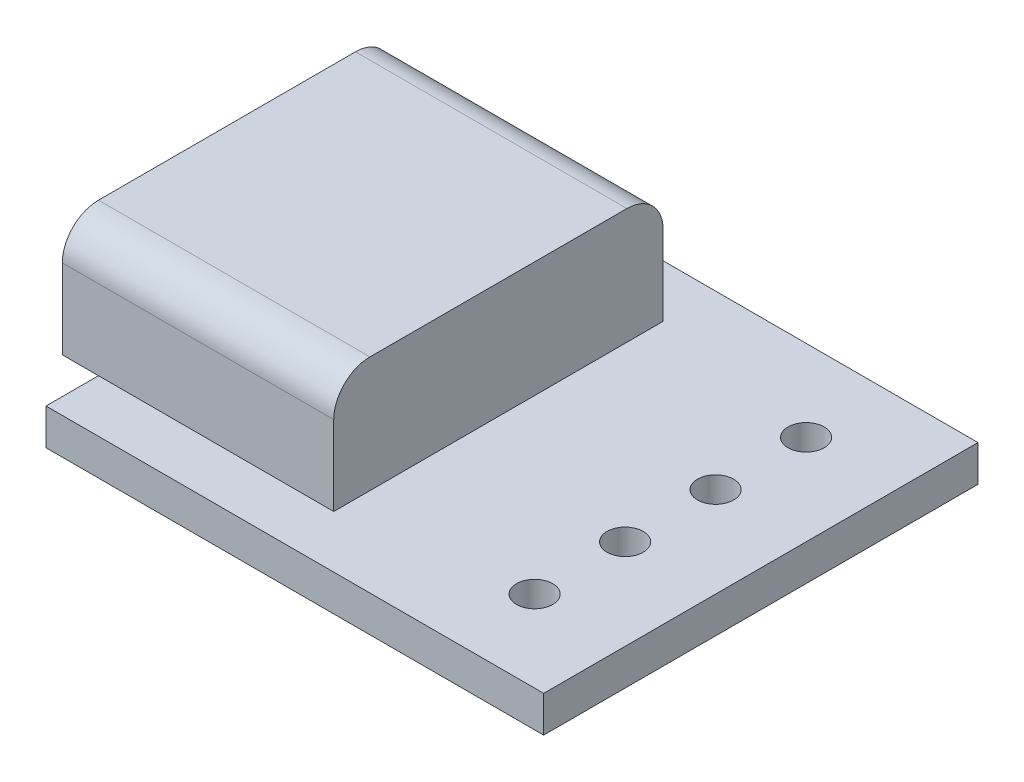
from build123d import *

# Parameters (mm, degrees)
SKETCH1_R           = 0.5
SKETCH1_W           = 6.5
SKETCH1_H           = 9.1
BOSS_EXTRUDE1_DEPTH = 1
BOSS_EXTRUDE2_START = 1
SKETCH1_3_W         = 1
SKETCH1_3_H         = 9.1
SKETCH1_3_W_2       = 6.5
BOSS_EXTRUDE2_DEPTH = 3.2
FILLET1_R           = 1


with BuildPart() as part:
    # Sketch1 → Boss-Extrude1 (new body)
    # profile 1 of 2: a face of its own
    with BuildSketch(Plane(origin=(0, 0, 0), x_dir=(1, 0, 0), z_dir=(0, 1, 0))):
        Polygon((0, 1.45), (0, 0), (13.75, 0), (13.75, 12), (0, 12), (0, 10.55), (6.5, 10.55), (6.5, 1.45), align=None)
        with Locations(Location((11.25, 2.25, 0), (0, 0, 270))):
            Circle(SKETCH1_R, mode=Mode.SUBTRACT)
        with Locations(Location((11.25, 4.75, 0), (0, 0, 270))):
            Circle(SKETCH1_R, mode=Mode.SUBTRACT)
        with Locations(Location((11.25, 7.25, 0), (0, 0, 270))):
            Circle(SKETCH1_R, mode=Mode.SUBTRACT)
        with Locations(Location((11.25, 9.75, 0), (0, 0, 270))):
            Circle(SKETCH1_R, mode=Mode.SUBTRACT)
    # profile 2 of 2: a face of its own
    with BuildSketch(Plane(origin=(0, 0, 0), x_dir=(1, 0, 0), z_dir=(0, 1, 0))):
        with Locations((3.25, 6)):
            Rectangle(SKETCH1_W, SKETCH1_H)
    extrude(amount=BOSS_EXTRUDE1_DEPTH)

    # Sketch1<3> → Boss-Extrude2 (add)
    with BuildSketch(Plane(origin=(0, 0, 0), x_dir=(1, 0, 0), z_dir=(0, 1, 0)).offset(BOSS_EXTRUDE2_START)):
        with Locations((-0.5, 6)):
            Rectangle(SKETCH1_3_W, SKETCH1_3_H)
        with Locations((3.25, 6)):
            Rectangle(SKETCH1_3_W_2, SKETCH1_3_H)
    extrude(amount=BOSS_EXTRUDE2_DEPTH)

    # Fillet1
    fillet1_edges = [part.edges().sort_by_distance(p)[0] for p in [
        (2.75, 4.2, -10.55),
        (2.75, 4.2, -1.45),
    ]]
    fillet(fillet1_edges, radius=FILLET1_R)


solid = part.part
